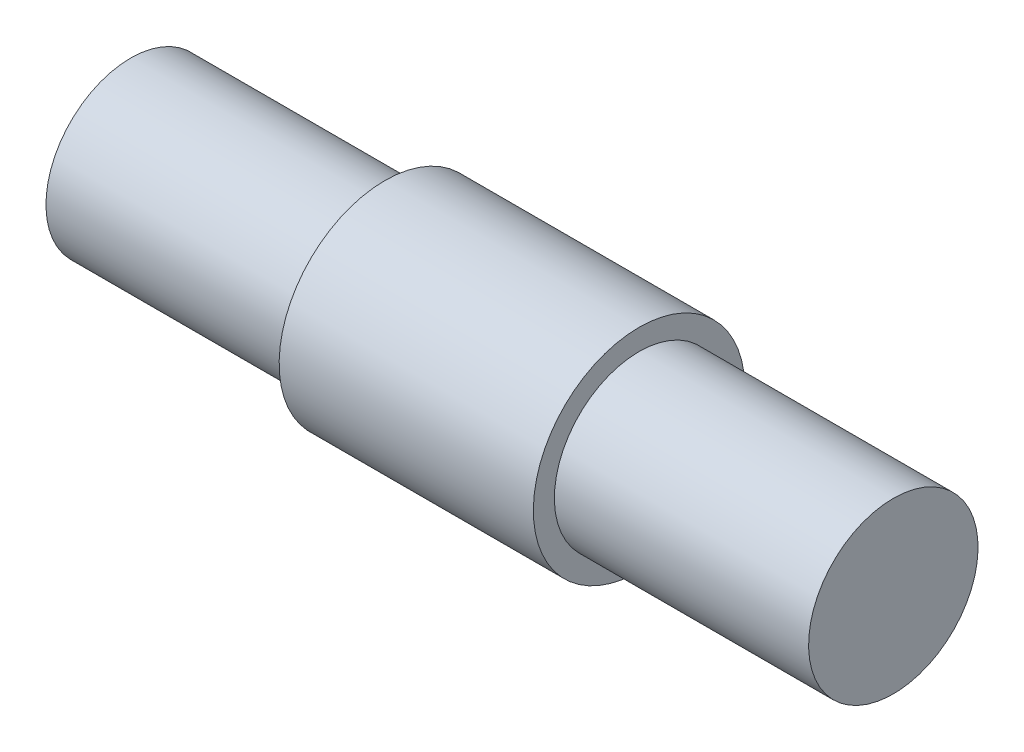
from build123d import *

# Parameters (mm, degrees)
SKETCH1_W = 9.525
SKETCH1_H = 3.175


with BuildPart() as part:
    # Sketch1 → Revolve1 (revolve)
    with BuildSketch(Plane.XY):
        with Locations((-9.525, 1.5875)):
            Rectangle(SKETCH1_W, SKETCH1_H)
        Polygon((-4.7625, 0), (0, 0), (0, 3.9624), (-4.7625, 3.9624), (-4.7625, 3.175), align=None)
        Polygon((0, 3.9624), (0, 0), (4.7625, 0), (4.7625, 3.175), (4.7625, 3.9624), align=None)
        with Locations((9.525, 1.5875)):
            Rectangle(SKETCH1_W, SKETCH1_H)
    revolve(axis=Axis((-4.7625, 0, 0), (-1, 0, 0)))


solid = part.part
